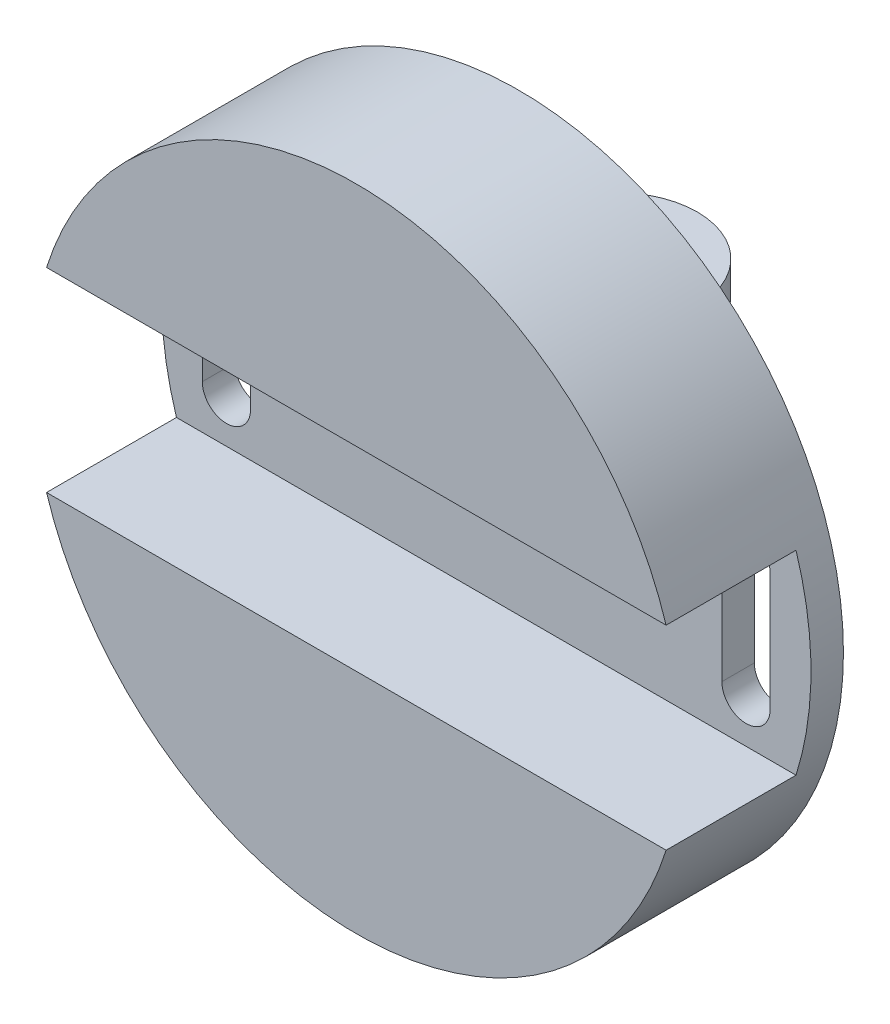
from build123d import *

# Parameters (mm, degrees)
SKETCH_1_R          = 50
EXTRUDE_1_DEPTH     = 25
SKETCH_3_W          = 50
SKETCH_3_H          = 20
CUT_EXTRUDE_1_DEPTH = 20
SKETCH_6_W          = 25
SKETCH_6_H          = 5
EXTRUDE_2_DEPTH     = 15
EXTRUDE_3_DEPTH     = 5
SKETCH_7_R          = 2.5
CUT_EXTRUDE_2_DEPTH = 91.311959341
SKETCH_9_W          = 137.55999238
SKETCH_9_H          = 30
CUT_EXTRUDE_3_DEPTH = 20
CUT_EXTRUDE_4_DEPTH = 78.821912081


with BuildPart() as part:
    # 草圖1 → 填料-伸長1 (new body)
    with BuildSketch(Plane.XY):
        Circle(SKETCH_1_R)
    extrude(amount=EXTRUDE_1_DEPTH)

    # 草圖3 → 除料-伸長1 (cut)
    with BuildSketch(Plane(origin=(0, 0, 0), x_dir=(-1, 0, 0), z_dir=(0, 0, -1))):
        with Locations((0, 30)):
            Rectangle(SKETCH_3_W, SKETCH_3_H)
        with Locations((0, -30)):
            Rectangle(SKETCH_3_W, SKETCH_3_H)
    extrude(amount=-CUT_EXTRUDE_1_DEPTH, mode=Mode.SUBTRACT)

    # 草圖6 → 填料-伸長2 (add)
    with BuildSketch(Plane(origin=(0, 0, 0), x_dir=(-1, 0, 0), z_dir=(0, 0, -1))):
        with Locations((0, 17.5)):
            Rectangle(SKETCH_6_W, SKETCH_6_H)
        with Locations((0, -17.5)):
            Rectangle(SKETCH_6_W, SKETCH_6_H)
    extrude(amount=EXTRUDE_2_DEPTH)

    # 草圖8 → 填料-伸長3 (add)
    with BuildSketch(Plane.XZ.offset(20)):
        with BuildLine():
            Line((-12.5, -15), (12.5, -15))
            ThreePointArc((12.5, -15), (0, -27.5), (-12.5, -15))
        make_face()
    extrude_3 = extrude(amount=-EXTRUDE_3_DEPTH)

    # 鏡射1: 填料-伸長3 across plane
    add(extrude_3.mirror(Plane.ZX))

    # 草圖7 → 除料-伸長2 (cut, through all)
    with BuildSketch(Plane(origin=(0, 20, 0), x_dir=(1, 0, 0), z_dir=(0, 1, 0))):
        with Locations(Location((0, 12.5, 0), (0, 0, 270))):
            Circle(SKETCH_7_R)
    extrude(amount=-CUT_EXTRUDE_2_DEPTH, mode=Mode.SUBTRACT)

    # 草圖9 → 除料-伸長3 (cut)
    with BuildSketch(Plane.XY.offset(25)):
        with Locations((-0.331949789, 0)):
            Rectangle(SKETCH_9_W, SKETCH_9_H)
    extrude(amount=-CUT_EXTRUDE_3_DEPTH, mode=Mode.SUBTRACT)

    # 草圖10 → 除料-伸長4 (cut, through all)
    with BuildSketch(Plane.XY.offset(5)):
        with BuildLine():
            Line((-36.282162368, 9.958493657), (-36.282162368, -8.232354756))
            ThreePointArc((-36.282162368, -8.232354756), (-40, -11.950192388), (-43.717837632, -8.232354756))
            Line((-43.717837632, -8.232354756), (-43.717837632, 9.958493657))
            ThreePointArc((-43.717837632, 9.958493657), (-40, 13.676331289), (-36.282162368, 9.958493657))
        make_face()
        with BuildLine():
            Line((36.282162368, 9.958493657), (36.282162368, -8.232354756))
            ThreePointArc((36.282162368, -8.232354756), (40, -11.950192388), (43.717837632, -8.232354756))
            Line((43.717837632, -8.232354756), (43.717837632, 9.958493657))
            ThreePointArc((43.717837632, 9.958493657), (40, 13.676331289), (36.282162368, 9.958493657))
        make_face()
    extrude(amount=-CUT_EXTRUDE_4_DEPTH, mode=Mode.SUBTRACT)


solid = part.part
